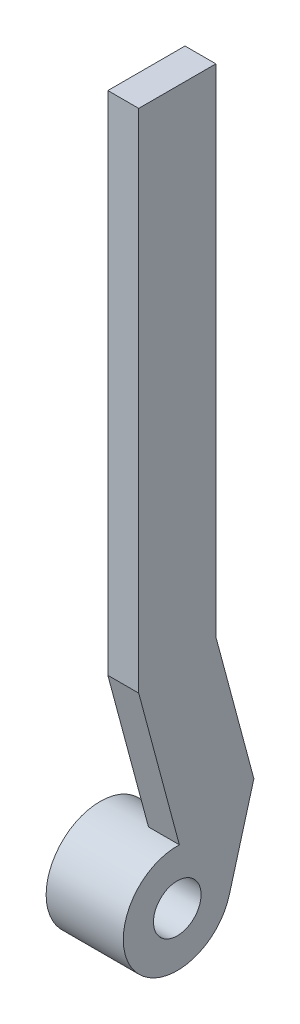
from build123d import *

# Parameters (mm, degrees)
SKETCH1_R           = 7
SKETCH1_R_2         = 3.0845
BOSS_EXTRUDE1_DEPTH = 10
BOSS_EXTRUDE2_START = 7
SKETCH1_3_R         = 7
BOSS_EXTRUDE2_DEPTH = 3
BOSS_EXTRUDE3_DEPTH = 4


with BuildPart() as part:
    # Sketch1 → Boss-Extrude1 (new body)
    with BuildSketch(Plane.ZY.offset(20.145)):
        Circle(SKETCH1_R)
        Circle(SKETCH1_R_2, mode=Mode.SUBTRACT)
    extrude(amount=BOSS_EXTRUDE1_DEPTH)

    # Sketch1<3> → Boss-Extrude2 (add)
    with BuildSketch(Plane.ZY.offset(20.145).offset(BOSS_EXTRUDE2_START)):
        Circle(SKETCH1_3_R)
    extrude(amount=BOSS_EXTRUDE2_DEPTH)

    # Sketch1<5> → Boss-Extrude3 (add)
    with BuildSketch(Plane.ZY.offset(20.145)):
        with BuildLine():
            Line((-5, 92.287872085), (-5, 27.967015644))
            Line((-5, 27.967015644), (-9.925953163, 9.583108165))
            Line((-9.925953163, 9.583108165), (-6.744787083, -1.872924772))
            ThreePointArc((-6.744787083, -1.872924772), (-5.652422268, 4.129179399), (-0.2666949, 6.994917714))
            Line((-0.2666949, 6.994917714), (5, 26.650490668))
            Line((5, 26.650490668), (5, 92.287872085))
            Line((5, 92.287872085), (-5, 92.287872085))
        make_face()
    extrude(amount=BOSS_EXTRUDE3_DEPTH)


solid = part.part
